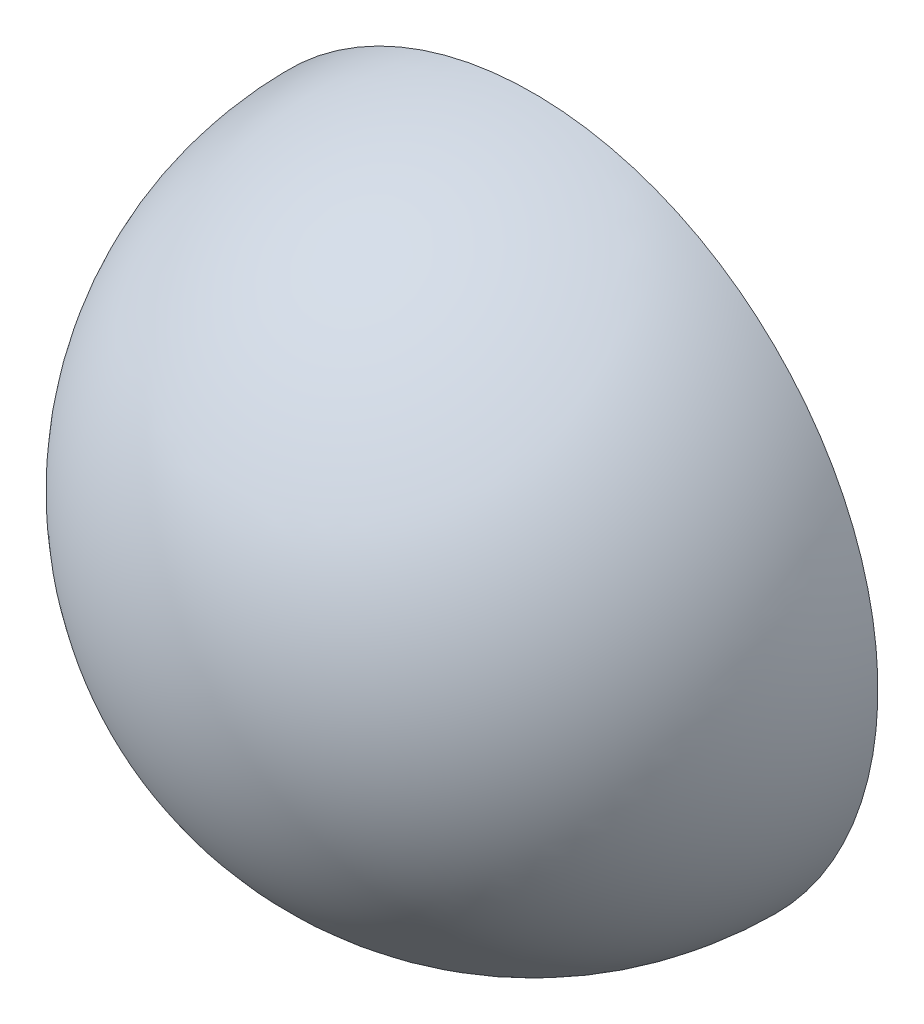
from build123d import *


with BuildPart() as part:
    # Эскиз1 → Повернуть1 (revolve)
    with BuildSketch(Plane(origin=(0, 0, 0), x_dir=(1, 0, 0), z_dir=(0, 1, 0))):
        with BuildLine():
            Line((0, 0), (0, -3))
            ThreePointArc((0, -3), (-2.121320344, -2.121320344), (-3, 0))
            Line((-3, 0), (0, 0))
        make_face()
    revolve(axis=Axis((0, 0, 0), (0, 0, 1)))


solid = part.part
